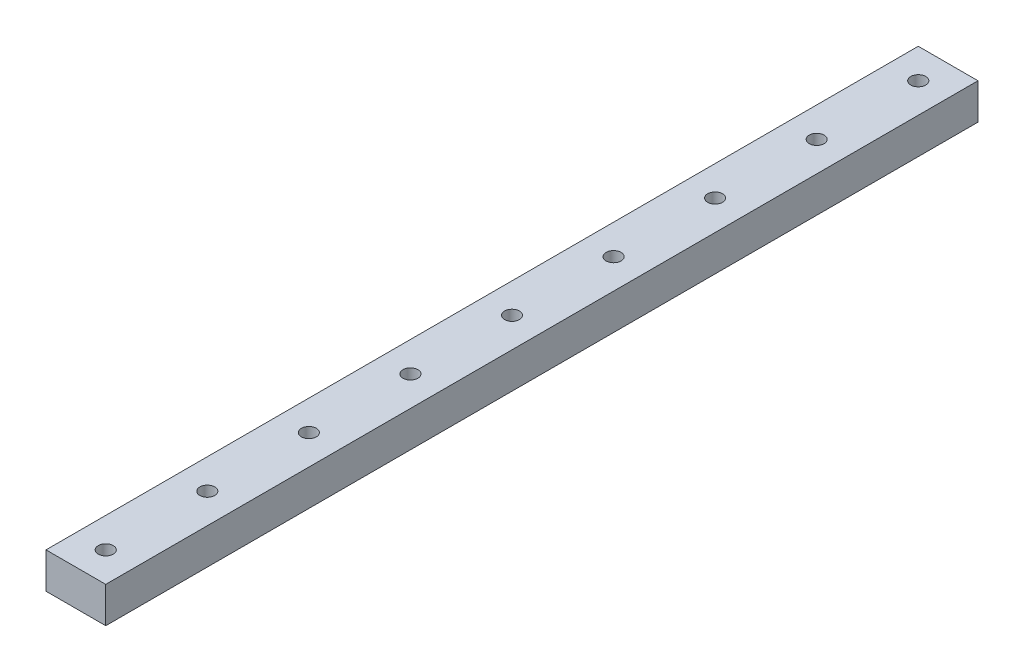
from build123d import *

# Parameters (mm, degrees)
SKETCH1_W           = 10
SKETCH1_H           = 146
BOSS_EXTRUDE1_DEPTH = 6
CUT_EXTRUDE1_REACH  = 75.417
SKETCH2_R           = 1.25
LPATTERN1_COUNT     = 9
LPATTERN1_PITCH     = 17


with BuildPart() as part:
    # Sketch1 → Boss-Extrude1 (new body)
    with BuildSketch(Plane(origin=(0, 0, 0), x_dir=(1, 0, 0), z_dir=(0, 1, 0))):
        Rectangle(SKETCH1_W, SKETCH1_H)
    extrude(amount=BOSS_EXTRUDE1_DEPTH)

    # Sketch2 → Cut-Extrude1 (cut, up to next)
    with BuildSketch(Plane(origin=(0, 6, 0), x_dir=(1, 0, 0), z_dir=(0, 1, 0)), mode=Mode.PRIVATE) as cut_extrude1_sk1:
        with Locations(Location((0, 68, 0), (0, 0, 270))):
            Circle(SKETCH2_R)
    cut_extrude1_tool1 = extrude(cut_extrude1_sk1.sketch, amount=-CUT_EXTRUDE1_REACH, mode=Mode.PRIVATE) & part.part
    cut_extrude1 = cut_extrude1_tool1.solids().sort_by_distance((0, 6, -68))[0]
    add(cut_extrude1, mode=Mode.SUBTRACT)

    # LPattern1: Cut-Extrude1 ×9
    with Locations(*[(0, 0, i * LPATTERN1_PITCH) for i in range(1, LPATTERN1_COUNT)]):
        add(cut_extrude1, mode=Mode.SUBTRACT)


solid = part.part
